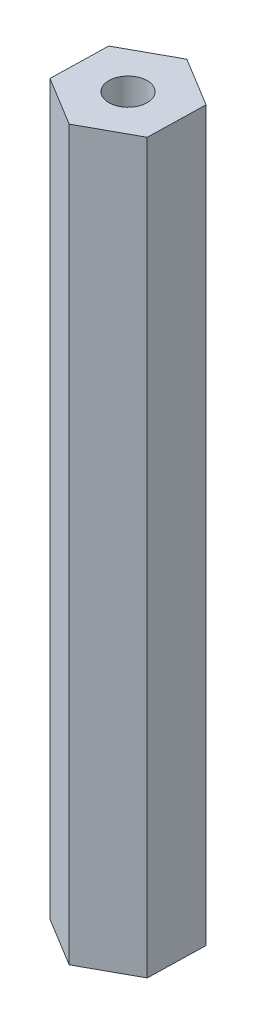
from build123d import *

# Parameters (mm, degrees)
BOSS_EXTRUDE1_DEPTH = 47.5
SKETCH1_3_R         = 2.5
CUT_EXTRUDE1_DEPTH  = 52


with BuildPart() as part:
    # Sketch1 → Boss-Extrude1 (new, symmetric)
    with BuildSketch(Plane(origin=(0, 0, 0), x_dir=(1, 0, 0), z_dir=(0, 1, 0))):
        Polygon((6.584646409, 3.602188918), (0.172736092, 7.503565524), (-6.411910317, 3.901376606), (-6.584646409, -3.602188918), (-0.172736092, -7.503565524), (6.411910317, -3.901376606), align=None)
    extrude(amount=BOSS_EXTRUDE1_DEPTH, both=True)

    # Sketch1<3> → Cut-Extrude1 (cut, symmetric)
    with BuildSketch(Plane(origin=(0, 0, 0), x_dir=(1, 0, 0), z_dir=(0, 1, 0))):
        Circle(SKETCH1_3_R)
    extrude(amount=CUT_EXTRUDE1_DEPTH, both=True, mode=Mode.SUBTRACT)


solid = part.part
